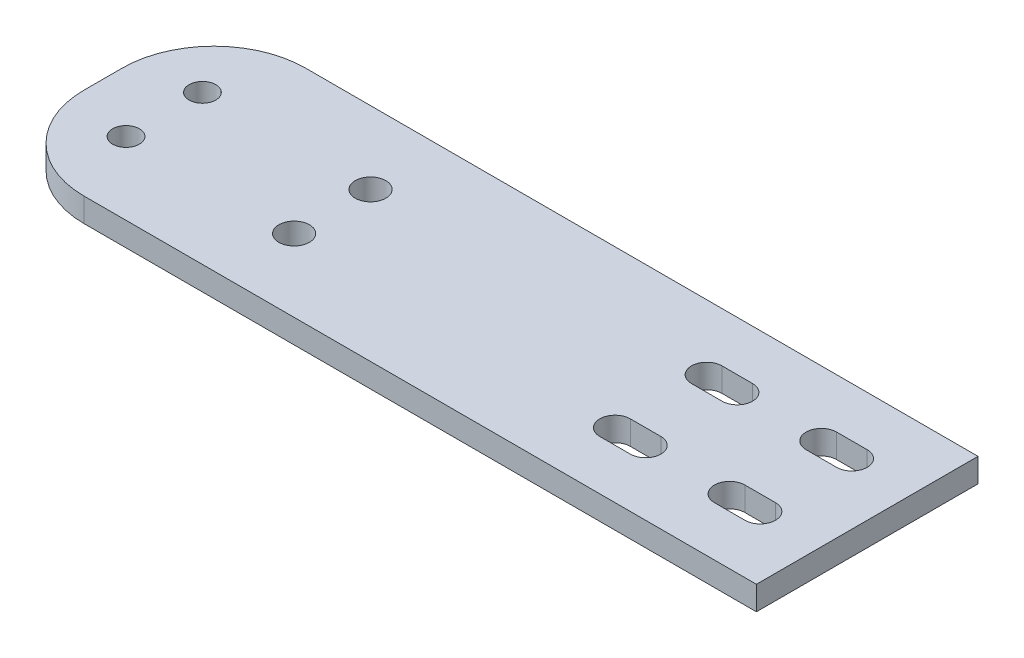
from build123d import *

# Parameters (mm, degrees)
SKETCH1_W           = 200
SKETCH1_H           = 58
BOSS_EXTRUDE1_DEPTH = 6.25
SKETCH2_R           = 3.5
CUT_EXTRUDE1_DEPTH  = 203.188185857
FILLET1_R           = 24
SKETCH3_R           = 4
CUT_EXTRUDE2_DEPTH  = 10


with BuildPart() as part:
    # Sketch1 → Boss-Extrude1 (new body)
    with BuildSketch(Plane(origin=(0, 0, 0), x_dir=(1, 0, 0), z_dir=(0, 1, 0))):
        with Locations((100, 0)):
            Rectangle(SKETCH1_W, SKETCH1_H)
    extrude(amount=BOSS_EXTRUDE1_DEPTH)

    # Sketch2 → Cut-Extrude1 (cut, through all)
    with BuildSketch(Plane(origin=(0, 0, 0), x_dir=(1, 0, 0), z_dir=(0, 1, 0))):
        with Locations(Location((16, 10, 0), (0, 0, 270))):
            Circle(SKETCH2_R)
        with Locations(Location((16, -10, 0), (0, 0, 270))):
            Circle(SKETCH2_R)
        with BuildLine():
            Line((176, 16), (184, 16))
            ThreePointArc((184, 16), (188, 12), (184, 8))
            Line((184, 8), (176, 8))
            ThreePointArc((176, 8), (172, 12), (176, 16))
        make_face()
        with BuildLine():
            Line((146, 16), (154, 16))
            ThreePointArc((154, 16), (158, 12), (154, 8))
            Line((154, 8), (146, 8))
            ThreePointArc((146, 8), (142, 12), (146, 16))
        make_face()
        with BuildLine():
            Line((146, -8), (154, -8))
            ThreePointArc((154, -8), (158, -12), (154, -16))
            Line((154, -16), (146, -16))
            ThreePointArc((146, -16), (142, -12), (146, -8))
        make_face()
        with BuildLine():
            Line((176, -8), (184, -8))
            ThreePointArc((184, -8), (188, -12), (184, -16))
            Line((184, -16), (176, -16))
            ThreePointArc((176, -16), (172, -12), (176, -8))
        make_face()
    extrude(amount=CUT_EXTRUDE1_DEPTH, mode=Mode.SUBTRACT)

    # Fillet1
    fillet1_edges = [part.edges().sort_by_distance(p)[0] for p in [
        (0, 3.125, -29),
        (0, 3.125, 29),
    ]]
    fillet(fillet1_edges, radius=FILLET1_R)

    # Sketch3 → Cut-Extrude2 (cut)
    with BuildSketch(Plane(origin=(0, 0, 0), x_dir=(1, 0, 0), z_dir=(0, 1, 0))):
        with Locations(Location((60, -10, 0), (0, 0, 270))):
            Circle(SKETCH3_R)
        with Locations(Location((60, 10, 0), (0, 0, 270))):
            Circle(SKETCH3_R)
    extrude(amount=CUT_EXTRUDE2_DEPTH, mode=Mode.SUBTRACT)


solid = part.part
